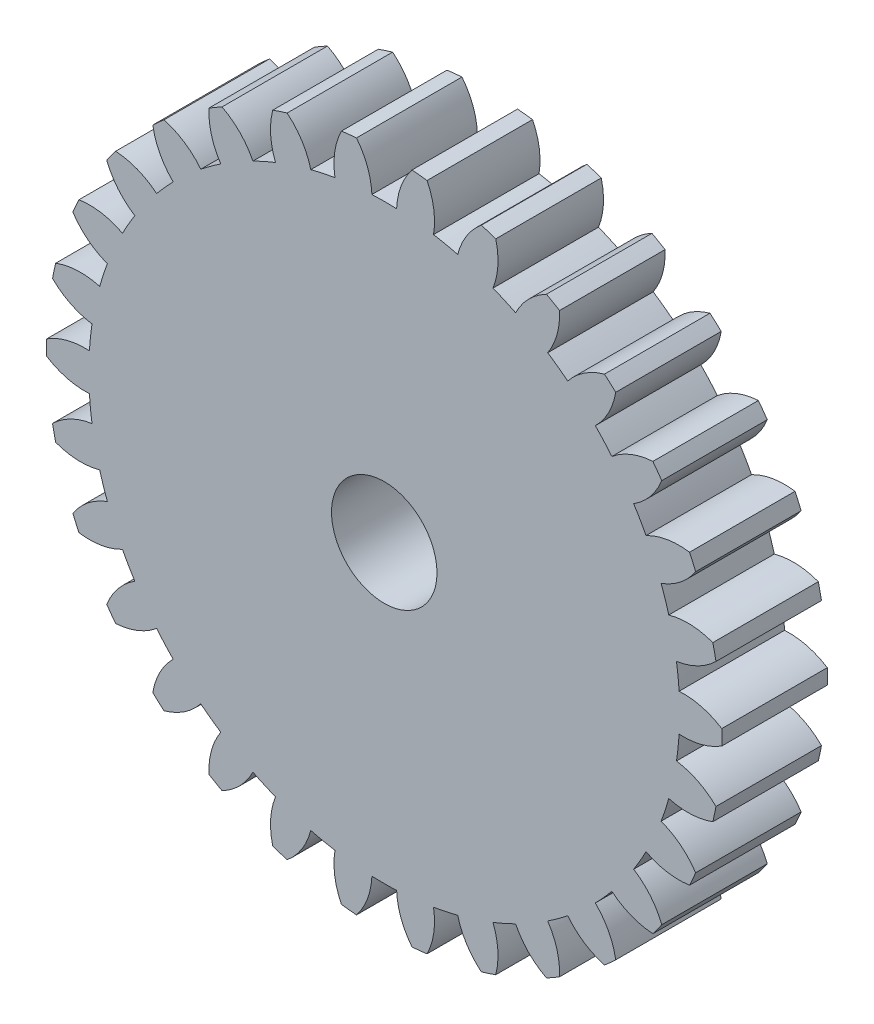
from build123d import *

# Parameters (mm, degrees)
SKETCH1_R           = 20.32
OUTER_CIRCLE_DEPTH  = 6.35
TOOTH_CUT_DEPTH     = 30.430040775
TEETH_PATTERN_COUNT = 30
SKETCH3_R           = 3.175
CUT_EXTRUDE1_DEPTH  = 30.382561533


with BuildPart() as part:
    # Sketch1 → Outer Circle (new body)
    with BuildSketch(Plane.XY):
        Circle(SKETCH1_R)
    extrude(amount=OUTER_CIRCLE_DEPTH)

    # Sketch2 → Tooth Cut (cut, through all)
    with BuildSketch(Plane.XY.offset(6.35)):
        with BuildLine():
            ThreePointArc((-0.743845606, 17.764433391), (0, 17.78), (0.743845606, 17.764433391))
            ThreePointArc((0.743845606, 17.764433391), (1.009950749, 19.081439594), (1.671040922, 20.251173355))
            ThreePointArc((1.671040922, 20.251173355), (0, 20.32), (-1.671040922, 20.251173355))
            ThreePointArc((-1.671040922, 20.251173355), (-1.009950749, 19.081439594), (-0.743845606, 17.764433391))
        make_face()
    tooth_cut = extrude(amount=-TOOTH_CUT_DEPTH, mode=Mode.SUBTRACT)

    # Teeth Pattern: Tooth Cut ×30 about axis
    teeth_pattern_axis = Axis((0, 0, 0), (0, 0, 1))
    for i in range(1, TEETH_PATTERN_COUNT):
        add(tooth_cut.rotate(teeth_pattern_axis, i * 360 / TEETH_PATTERN_COUNT), mode=Mode.SUBTRACT)

    # Sketch3 → Cut-Extrude1 (cut, through all)
    with BuildSketch(Plane.XY.offset(6.35)):
        Circle(SKETCH3_R)
    extrude(amount=-CUT_EXTRUDE1_DEPTH, mode=Mode.SUBTRACT)


solid = part.part
